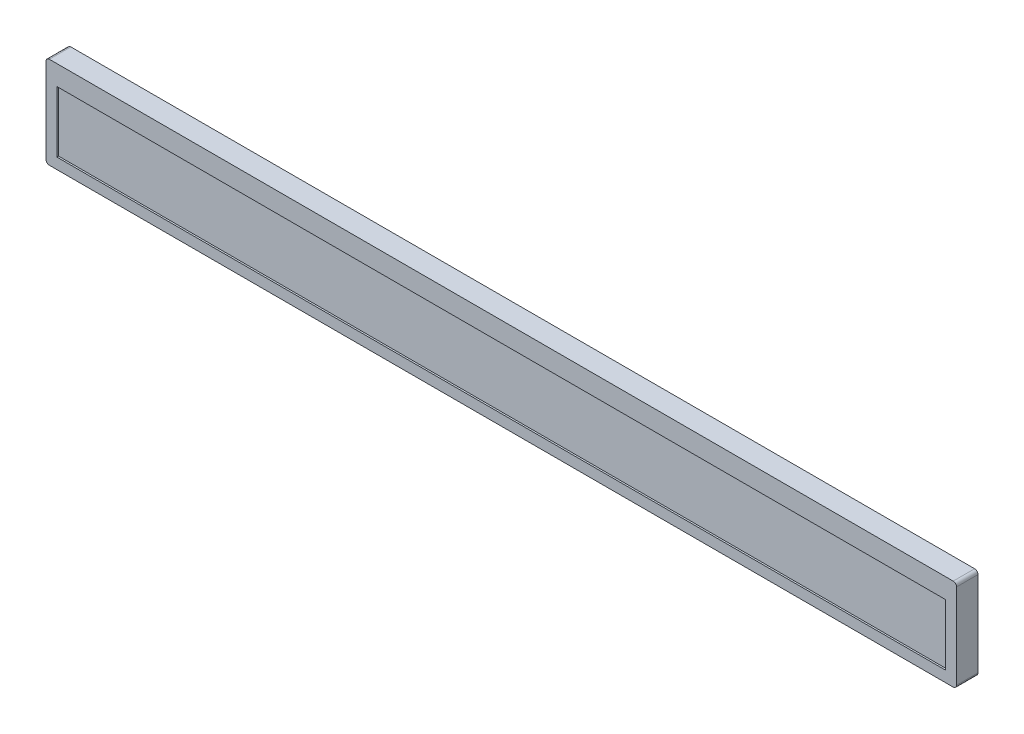
from build123d import *

# Parameters (mm, degrees)
BOSS_EXTRUDE1_DEPTH = 12.77
SKETCH2_W           = 529.42
SKETCH2_H           = 36.4
CUT_EXTRUDE1_DEPTH  = 1
SKETCH3_R           = 2.5
SKETCH3_W           = 34.32
SKETCH3_H           = 14.88
BOSS_EXTRUDE2_DEPTH = 1.25


with BuildPart() as part:
    # Sketch1 → Boss-Extrude1 (new body)
    with BuildSketch(Plane.XY):
        with BuildLine():
            Line((-269.21, 27.35), (269.21, 27.35))
            ThreePointArc((269.21, 27.35), (270.624213562, 26.764213562), (271.21, 25.35))
            Line((271.21, 25.35), (271.21, -25.35))
            ThreePointArc((271.21, -25.35), (270.624213562, -26.764213562), (269.21, -27.35))
            Line((269.21, -27.35), (-269.21, -27.35))
            ThreePointArc((-269.21, -27.35), (-270.624213562, -26.764213562), (-271.21, -25.35))
            Line((-271.21, -25.35), (-271.21, 25.35))
            ThreePointArc((-271.21, 25.35), (-270.624213562, 26.764213562), (-269.21, 27.35))
        make_face()
    extrude(amount=BOSS_EXTRUDE1_DEPTH)

    # Sketch2 → Cut-Extrude1 (cut)
    with BuildSketch(Plane.XY.offset(12.77)):
        with Locations((0, -2.67)):
            Rectangle(SKETCH2_W, SKETCH2_H)
    extrude(amount=-CUT_EXTRUDE1_DEPTH, mode=Mode.SUBTRACT)

    # Sketch3 → Boss-Extrude2 (add)
    with BuildSketch(Plane(origin=(0, 0, 0), x_dir=(-1, 0, 0), z_dir=(0, 0, -1))):
        with Locations((-253.41, 4.02)):
            Circle(SKETCH3_R)
        with Locations((-253.41, -10.06)):
            Circle(SKETCH3_R)
        with Locations((-113, -10.06)):
            Circle(SKETCH3_R)
        with Locations(Location((113, -10.06, 0), (0, 0, 180))):
            Circle(SKETCH3_R)
        with Locations(Location((253.41, -10.06, 0), (0, 0, 180))):
            Circle(SKETCH3_R)
        with Locations(Location((253.41, 4.02, 0), (0, 0, 180))):
            Circle(SKETCH3_R)
        with Locations((0, -19.91)):
            Rectangle(SKETCH3_W, SKETCH3_H)
    extrude(amount=BOSS_EXTRUDE2_DEPTH)


solid = part.part
